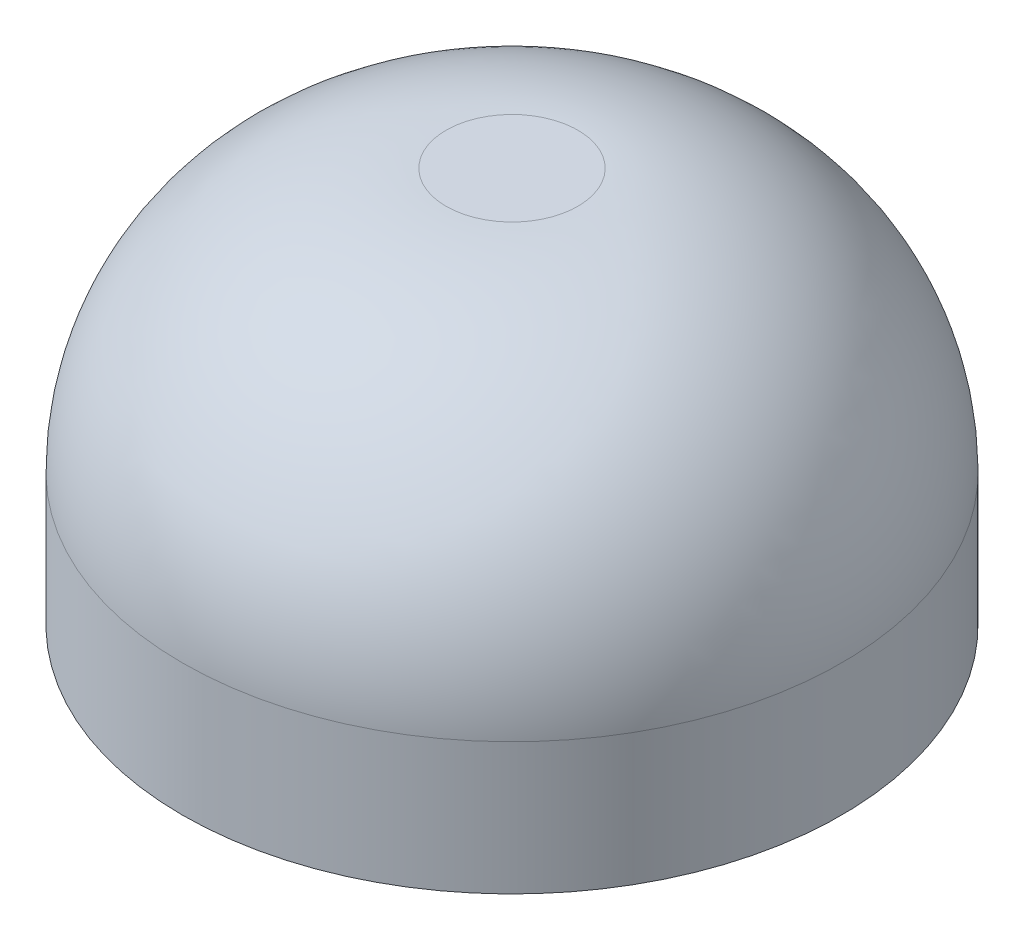
from build123d import *

# Parameters (mm, degrees)
SKETCH1_R           = 2.5
BOSS_EXTRUDE1_DEPTH = 3
SKETCH3_R           = 0.5
CUT_EXTRUDE1_DEPTH  = 1.5
FILLET1_R           = 2


with BuildPart() as part:
    # Sketch1 → Boss-Extrude1 (new body)
    with BuildSketch(Plane(origin=(0, 0, 0), x_dir=(1, 0, 0), z_dir=(0, 1, 0))):
        with Locations(Location((0, 0, 0), (0, 0, 270))):
            Circle(SKETCH1_R)
    extrude(amount=BOSS_EXTRUDE1_DEPTH)

    # Sketch3 → Cut-Extrude1 (cut)
    with BuildSketch(Plane(origin=(0, 0, 0), x_dir=(1, 0, 0), z_dir=(0, 1, 0))):
        with Locations(Location((0, 0, 0), (0, 0, 270))):
            Circle(SKETCH3_R)
    extrude(amount=CUT_EXTRUDE1_DEPTH, mode=Mode.SUBTRACT)

    # Fillet1
    fillet1_edges = [part.edges().sort_by_distance(p)[0] for p in [
        (0, 3, -2.5),
    ]]
    fillet(fillet1_edges, radius=FILLET1_R)


solid = part.part
